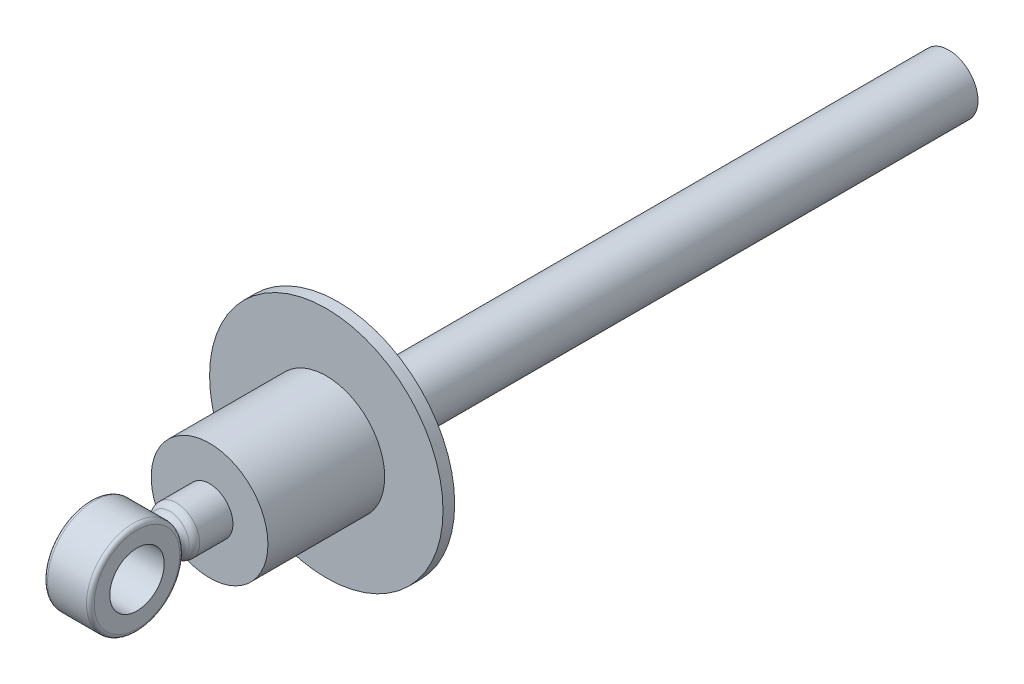
from build123d import *

# Parameters (mm, degrees)
SKETCH2_4_R         = 7
BOSS_EXTRUDE1_DEPTH = 6
FILLET1_R           = 1
FILLET2_R           = 2


with BuildPart() as part:
    # Sketch1 → Revolve1 (revolve)
    with BuildSketch(Plane.YZ):
        Polygon((6, 43), (0, 43), (0, -157), (7.5, -157), (7.5, -3), (20, -3), (20, 0), (30, 0), (30, 3), (15, 3), (15, 33), (6, 33), align=None)
    revolve(axis=Axis((0, 0, 49.693213244), (0, 0, -1)))

    # Sketch2 → Revolve2 (revolve)
    with BuildSketch(Plane.YZ):
        with BuildLine():
            ThreePointArc((5.142857143, 46.807015806), (2.63579798, 45.942165309), (0, 45.649110641))
            Line((0, 45.649110641), (0, 43))
            Line((0, 43), (6, 43))
            ThreePointArc((6, 43), (4.048842445, 44.560700337), (5.142857143, 46.807015806))
        make_face()
    revolve(axis=Axis((0, 0, 57.649110641), (0, 0, -1)))

    # Sketch2<4> → Boss-Extrude1 (add, symmetric)
    with BuildSketch(Plane.YZ):
        with BuildLine():
            ThreePointArc((-5.142857143, 46.807015806), (-2.63579798, 45.942165309), (0, 45.649110641))
            ThreePointArc((0, 45.649110641), (2.63579798, 45.942165309), (5.142857143, 46.807015806))
            ThreePointArc((5.142857143, 46.807015806), (10.141851057, 51.234840835), (12, 57.649110641))
            ThreePointArc((12, 57.649110641), (-6.414269806, 67.790961697), (-5.142857143, 46.807015806))
        make_face()
        with Locations((0, 57.649110641)):
            Circle(SKETCH2_4_R, mode=Mode.SUBTRACT)
    extrude(amount=BOSS_EXTRUDE1_DEPTH, both=True)

    # Fillet1
    fillet1_edges = [part.edges().sort_by_distance(p)[0] for p in [
        (-6, -2.63579798, 45.942165309),
        (6, 2.63579798, 45.942165309),
    ]]
    fillet(fillet1_edges, radius=FILLET1_R)

    # Fillet2
    fillet2_edges = [part.edges().sort_by_distance(p)[0] for p in [
        (0, -6, 43),
    ]]
    fillet(fillet2_edges, radius=FILLET2_R)


solid = part.part
